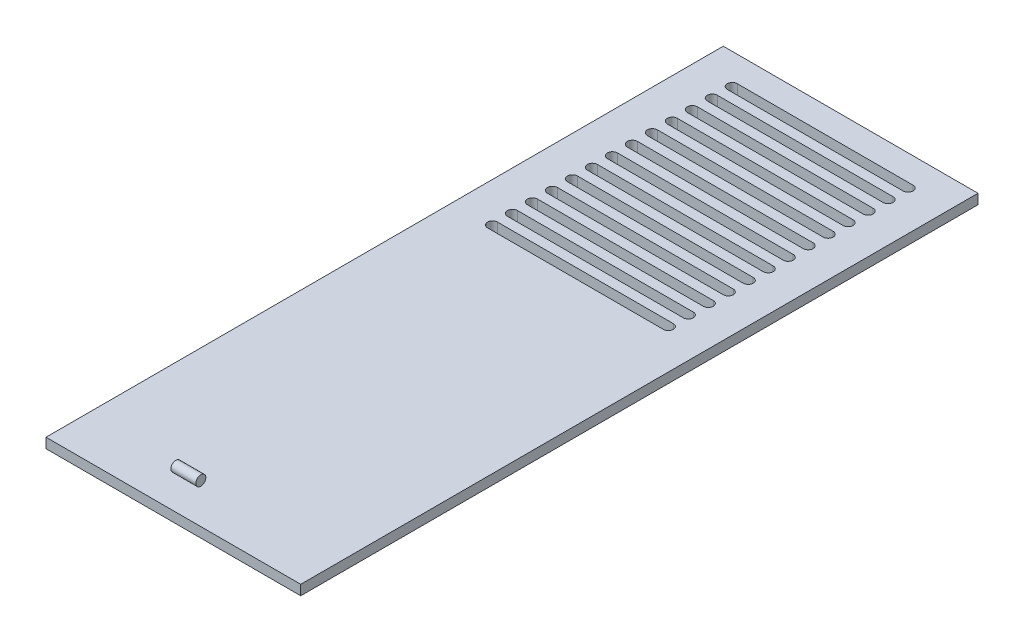
from build123d import *

# Parameters (mm, degrees)
SKETCH1_W           = 51
SKETCH1_H           = 136
BOSS_EXTRUDE1_DEPTH = 2
CUT_EXTRUDE1_DEPTH  = 10
SKETCH5_W           = 1
SKETCH5_H           = 2
BOSS_EXTRUDE2_DEPTH = 136
SKETCH6_W           = 1
SKETCH6_H           = 2
BOSS_EXTRUDE3_DEPTH = 136
SKETCH7_W           = 68.795835126
SKETCH7_H           = 26.425628728
CUT_EXTRUDE2_DEPTH  = 0.4
SKETCH8_W           = 2
SKETCH8_H           = 2
CUT_EXTRUDE3_DEPTH  = 135.6
SKETCH9_R           = 1
BOSS_EXTRUDE4_DEPTH = 2.5


with BuildPart() as part:
    # Sketch1 → Boss-Extrude1 (new body)
    with BuildSketch(Plane(origin=(0, 0, 0), x_dir=(1, 0, 0), z_dir=(0, 1, 0))):
        with Locations((-30.5, -4.545454545)):
            Rectangle(SKETCH1_W, SKETCH1_H)
    extrude(amount=BOSS_EXTRUDE1_DEPTH)

    # Sketch4 → Cut-Extrude1 (cut)
    with BuildSketch(Plane(origin=(0, 2, 0), x_dir=(1, 0, 0), z_dir=(0, 1, 0))):
        with BuildLine():
            Line((-48.1, 58.354545455), (-12.9, 58.354545455))
            ThreePointArc((-12.9, 58.354545455), (-11.9, 57.354545455), (-12.9, 56.354545455))
            Line((-12.9, 56.354545455), (-48.1, 56.354545455))
            ThreePointArc((-48.1, 56.354545455), (-49.1, 57.354545455), (-48.1, 58.354545455))
        make_face()
        with BuildLine():
            Line((-48.1, 54.354545455), (-12.9, 54.354545455))
            ThreePointArc((-12.9, 54.354545455), (-11.9, 53.354545455), (-12.9, 52.354545455))
            Line((-12.9, 52.354545455), (-48.1, 52.354545455))
            ThreePointArc((-48.1, 52.354545455), (-49.1, 53.354545455), (-48.1, 54.354545455))
        make_face()
        with BuildLine():
            Line((-48.1, 50.354545455), (-12.9, 50.354545455))
            ThreePointArc((-12.9, 50.354545455), (-11.9, 49.354545455), (-12.9, 48.354545455))
            Line((-12.9, 48.354545455), (-48.1, 48.354545455))
            ThreePointArc((-48.1, 48.354545455), (-49.1, 49.354545455), (-48.1, 50.354545455))
        make_face()
        with BuildLine():
            Line((-48.1, 46.354545455), (-12.9, 46.354545455))
            ThreePointArc((-12.9, 46.354545455), (-11.9, 45.354545455), (-12.9, 44.354545455))
            Line((-12.9, 44.354545455), (-48.1, 44.354545455))
            ThreePointArc((-48.1, 44.354545455), (-49.1, 45.354545455), (-48.1, 46.354545455))
        make_face()
        with BuildLine():
            Line((-48.1, 42.354545455), (-12.9, 42.354545455))
            ThreePointArc((-12.9, 42.354545455), (-11.9, 41.354545455), (-12.9, 40.354545455))
            Line((-12.9, 40.354545455), (-48.1, 40.354545455))
            ThreePointArc((-48.1, 40.354545455), (-49.1, 41.354545455), (-48.1, 42.354545455))
        make_face()
        with BuildLine():
            Line((-48.1, 38.354545455), (-12.9, 38.354545455))
            ThreePointArc((-12.9, 38.354545455), (-11.9, 37.354545455), (-12.9, 36.354545455))
            Line((-12.9, 36.354545455), (-48.1, 36.354545455))
            ThreePointArc((-48.1, 36.354545455), (-49.1, 37.354545455), (-48.1, 38.354545455))
        make_face()
        with BuildLine():
            Line((-48.1, 34.354545455), (-12.9, 34.354545455))
            ThreePointArc((-12.9, 34.354545455), (-11.9, 33.354545455), (-12.9, 32.354545455))
            Line((-12.9, 32.354545455), (-48.1, 32.354545455))
            ThreePointArc((-48.1, 32.354545455), (-49.1, 33.354545455), (-48.1, 34.354545455))
        make_face()
        with BuildLine():
            Line((-48.1, 30.354545455), (-12.9, 30.354545455))
            ThreePointArc((-12.9, 30.354545455), (-11.9, 29.354545455), (-12.9, 28.354545455))
            Line((-12.9, 28.354545455), (-48.1, 28.354545455))
            ThreePointArc((-48.1, 28.354545455), (-49.1, 29.354545455), (-48.1, 30.354545455))
        make_face()
        with BuildLine():
            Line((-48.1, 26.354545455), (-12.9, 26.354545455))
            ThreePointArc((-12.9, 26.354545455), (-11.9, 25.354545455), (-12.9, 24.354545455))
            Line((-12.9, 24.354545455), (-48.1, 24.354545455))
            ThreePointArc((-48.1, 24.354545455), (-49.1, 25.354545455), (-48.1, 26.354545455))
        make_face()
        with BuildLine():
            Line((-48.1, 22.354545455), (-12.9, 22.354545455))
            ThreePointArc((-12.9, 22.354545455), (-11.9, 21.354545455), (-12.9, 20.354545455))
            Line((-12.9, 20.354545455), (-48.1, 20.354545455))
            ThreePointArc((-48.1, 20.354545455), (-49.1, 21.354545455), (-48.1, 22.354545455))
        make_face()
        with BuildLine():
            Line((-48.1, 18.354545455), (-12.9, 18.354545455))
            ThreePointArc((-12.9, 18.354545455), (-11.9, 17.354545455), (-12.9, 16.354545455))
            Line((-12.9, 16.354545455), (-48.1, 16.354545455))
            ThreePointArc((-48.1, 16.354545455), (-49.1, 17.354545455), (-48.1, 18.354545455))
        make_face()
        with BuildLine():
            Line((-48.1, 14.354545455), (-12.9, 14.354545455))
            ThreePointArc((-12.9, 14.354545455), (-11.9, 13.354545455), (-12.9, 12.354545455))
            Line((-12.9, 12.354545455), (-48.1, 12.354545455))
            ThreePointArc((-48.1, 12.354545455), (-49.1, 13.354545455), (-48.1, 14.354545455))
        make_face()
        with BuildLine():
            Line((-48.1, 10.354545455), (-12.9, 10.354545455))
            ThreePointArc((-12.9, 10.354545455), (-11.9, 9.354545455), (-12.9, 8.354545455))
            Line((-12.9, 8.354545455), (-48.1, 8.354545455))
            ThreePointArc((-48.1, 8.354545455), (-49.1, 9.354545455), (-48.1, 10.354545455))
        make_face()
    extrude(amount=-CUT_EXTRUDE1_DEPTH, mode=Mode.SUBTRACT)

    # Sketch5 → Boss-Extrude2 (add)
    with BuildSketch(Plane(origin=(0, 0, -63.454545455), x_dir=(-1, 0, 0), z_dir=(0, 0, -1))):
        with Locations((56.5, 1)):
            Rectangle(SKETCH5_W, SKETCH5_H)
        with Locations((4.5, 1)):
            Rectangle(SKETCH5_W, SKETCH5_H)
    extrude(amount=-BOSS_EXTRUDE2_DEPTH)

    # Sketch6 → Boss-Extrude3 (add)
    with BuildSketch(Plane(origin=(0, 0, -63.454545455), x_dir=(-1, 0, 0), z_dir=(0, 0, -1))):
        with Locations((57.5, 1)):
            Rectangle(SKETCH6_W, SKETCH6_H)
        with Locations((3.5, 1)):
            Rectangle(SKETCH6_W, SKETCH6_H)
    extrude(amount=-BOSS_EXTRUDE3_DEPTH)

    # Sketch7 → Cut-Extrude2 (cut)
    with BuildSketch(Plane.XY.offset(72.545454545)):
        with Locations((-32.339758962, -3.400766566)):
            Rectangle(SKETCH7_W, SKETCH7_H)
    extrude(amount=-CUT_EXTRUDE2_DEPTH, mode=Mode.SUBTRACT)

    # Sketch8 → Cut-Extrude3 (cut)
    with BuildSketch(Plane(origin=(0, 0, -63.454545455), x_dir=(-1, 0, 0), z_dir=(0, 0, -1))):
        with Locations((4, 1)):
            Rectangle(SKETCH8_W, SKETCH8_H)
        with Locations((57, 1)):
            Rectangle(SKETCH8_W, SKETCH8_H)
    extrude(amount=-CUT_EXTRUDE3_DEPTH, mode=Mode.SUBTRACT)


with BuildPart() as body_2:
    # Sketch9 → Boss-Extrude4 (new, symmetric)
    with BuildSketch(Plane.ZY.offset(30.5)):
        with Locations(Location((69.145454545, 7, 0), (0, 0, 270))):
            Circle(SKETCH9_R)
    extrude(amount=BOSS_EXTRUDE4_DEPTH, both=True)


solid = Compound([part.part, body_2.part])
